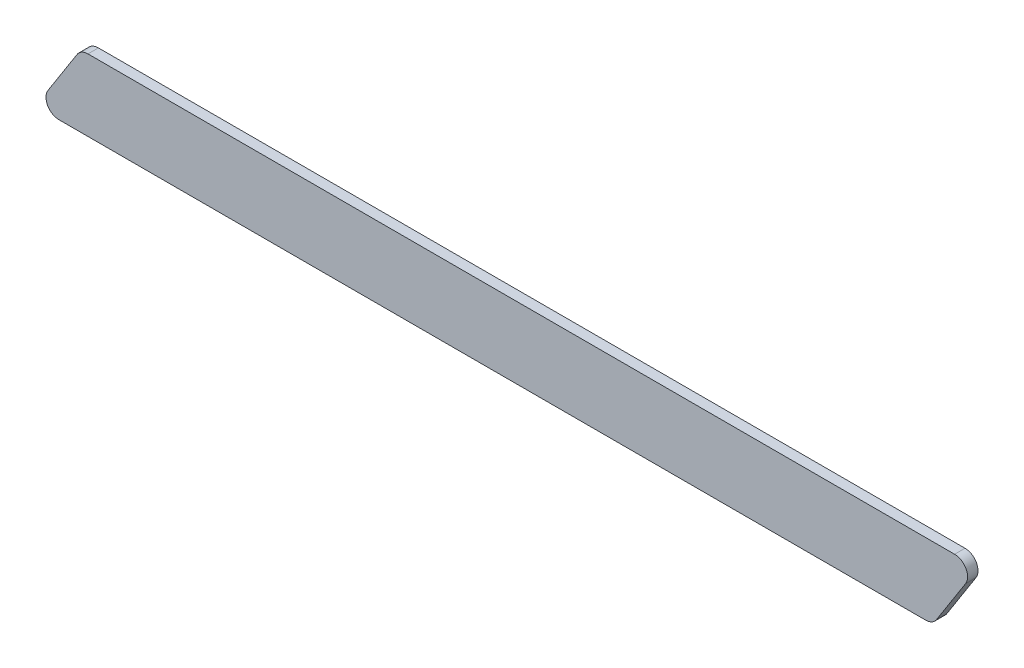
from build123d import *

# Parameters (mm, degrees)
SKETCH1_W           = 145
SKETCH1_H           = 11
BOSS_EXTRUDE1_DEPTH = 1.6
CUT_EXTRUDE1_DEPTH  = 73.725923851
FILLET2_R           = 2


with BuildPart() as part:
    # Sketch1 → Boss-Extrude1 (new body)
    with BuildSketch(Plane.XY):
        Rectangle(SKETCH1_W, SKETCH1_H)
    extrude(amount=BOSS_EXTRUDE1_DEPTH)

    # Sketch2 → Cut-Extrude1 (cut, through all)
    with BuildSketch(Plane.XY.offset(1.6)):
        Polygon((-72.5, -5.5), (-65.5, 5.5), (-72.5, 5.5), align=None)
        Polygon((72.5, 5.5), (65.5, -5.5), (72.5, -5.5), align=None)
    extrude(amount=-CUT_EXTRUDE1_DEPTH, mode=Mode.SUBTRACT)

    # Fillet2
    fillet2_edges = [part.edges().sort_by_distance(p)[0] for p in [
        (72.5, 5.5, 0.8),
        (65.5, -5.5, 0.8),
        (-72.5, -5.5, 0.8),
        (-65.5, 5.5, 0.8),
    ]]
    fillet(fillet2_edges, radius=FILLET2_R)


solid = part.part
